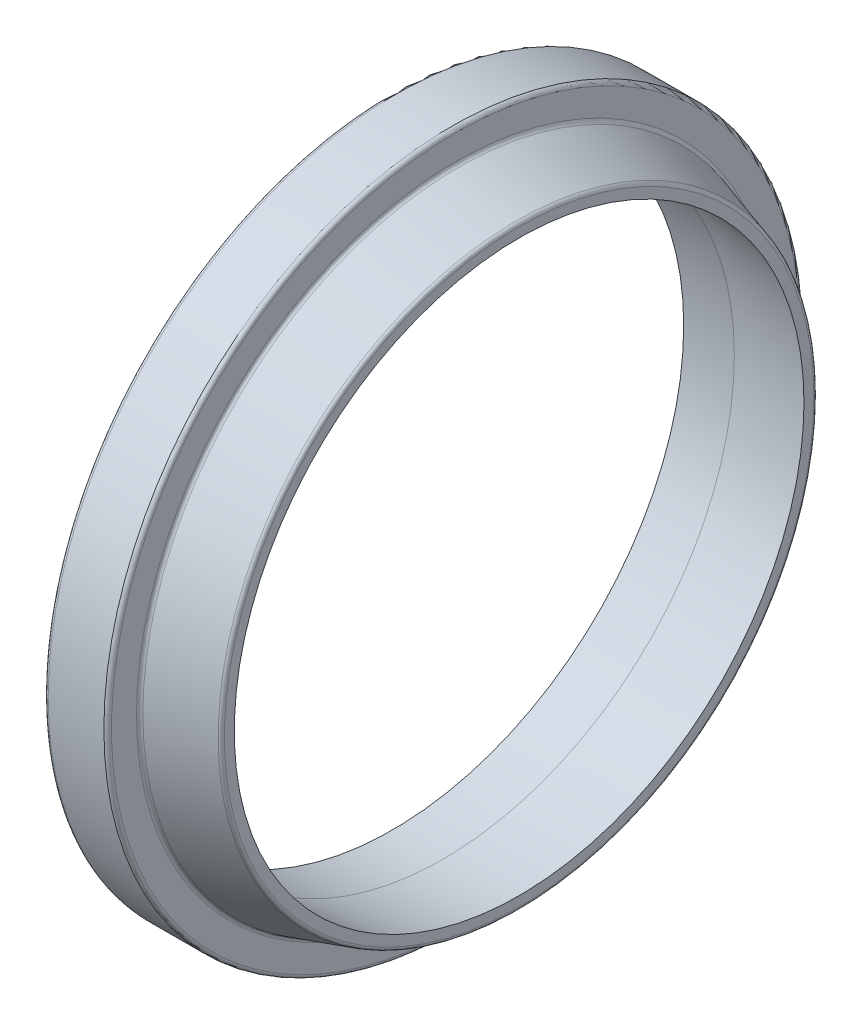
from build123d import *


with BuildPart() as part:
    # Sketch1 → Revolve1 (revolve)
    with BuildSketch(Plane.XY, mode=Mode.PRIVATE) as revolve1_sk:
        with BuildLine():
            Line((0.3, 5), (4.7, 5))
            ThreePointArc((4.7, 5), (4.912132034, 4.912132034), (5, 4.7))
            Line((5, 4.7), (5, 2.723209195))
            ThreePointArc((5, 2.723209195), (5.059312122, 2.544130036), (5.213795634, 2.43586131))
            Line((5.213795634, 2.43586131), (9.786204366, 1.06413869))
            ThreePointArc((9.786204366, 1.06413869), (9.940687878, 0.955869964), (10, 0.776790805))
            Line((10, 0.776790805), (10, 0))
            Line((10, 0), (4, 0.5))
            Line((4, 0.5), (0, 0.5))
            Line((0, 0.5), (0, 4.7))
            ThreePointArc((0, 4.7), (0.087867966, 4.912132034), (0.3, 5))
        make_face()
    revolve(revolve1_sk.sketch.rotate(Axis((10, -22.5, 0), (-1, 0, 0)), 90), axis=Axis((10, -22.5, 0), (-1, 0, 0)))


solid = part.part
